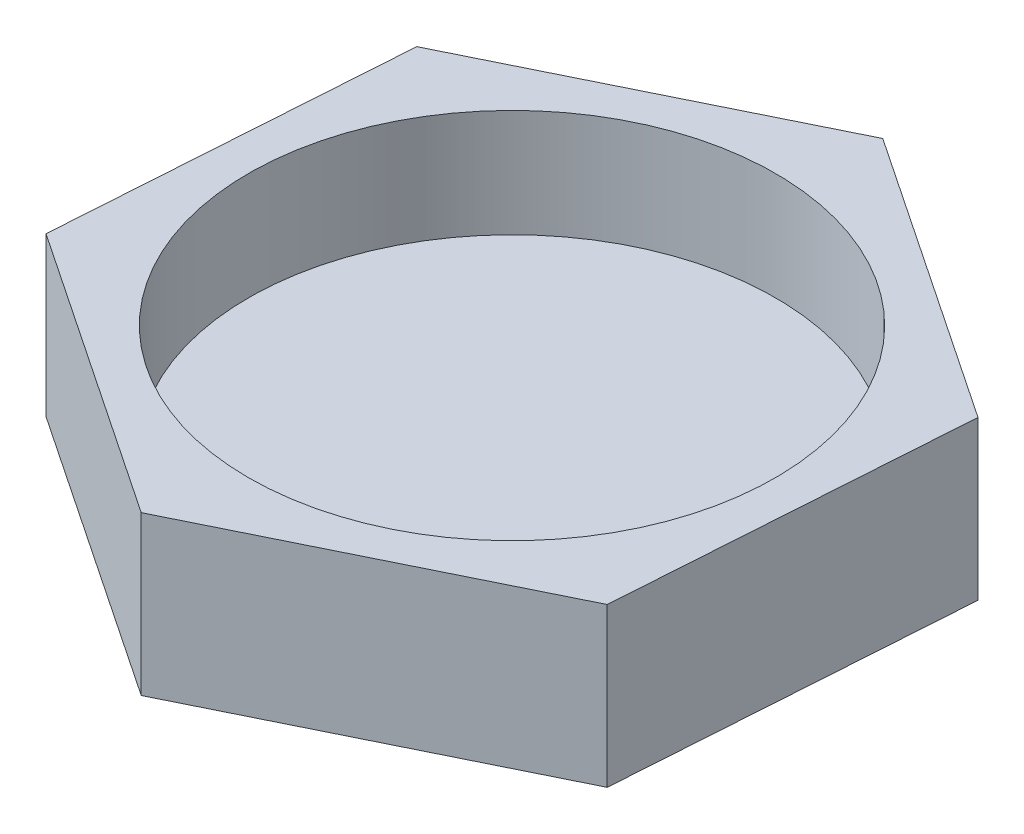
from build123d import *

# Parameters (mm, degrees)
BOSS_EXTRUDE1_DEPTH = 7.9375
SKETCH2_R           = 13.208
CUT_EXTRUDE1_DEPTH  = 5.3975


with BuildPart() as part:
    # Sketch1 → Boss-Extrude1 (new body)
    with BuildSketch(Plane(origin=(0, 0, 0), x_dir=(1, 0, 0), z_dir=(0, 1, 0))):
        Polygon((14.493254159, -9.720216521), (15.664581517, 7.691418025), (1.171327358, 17.411634546), (-14.493254159, 9.720216521), (-15.664581517, -7.691418025), (-1.171327358, -17.411634546), align=None)
    extrude(amount=BOSS_EXTRUDE1_DEPTH)

    # Sketch2 → Cut-Extrude1 (cut)
    with BuildSketch(Plane(origin=(0, 7.9375, 0), x_dir=(1, 0, 0), z_dir=(0, 1, 0))):
        with Locations(Location((0, 0, 0), (0, 0, 270))):
            Circle(SKETCH2_R)
    extrude(amount=-CUT_EXTRUDE1_DEPTH, mode=Mode.SUBTRACT)


solid = part.part
